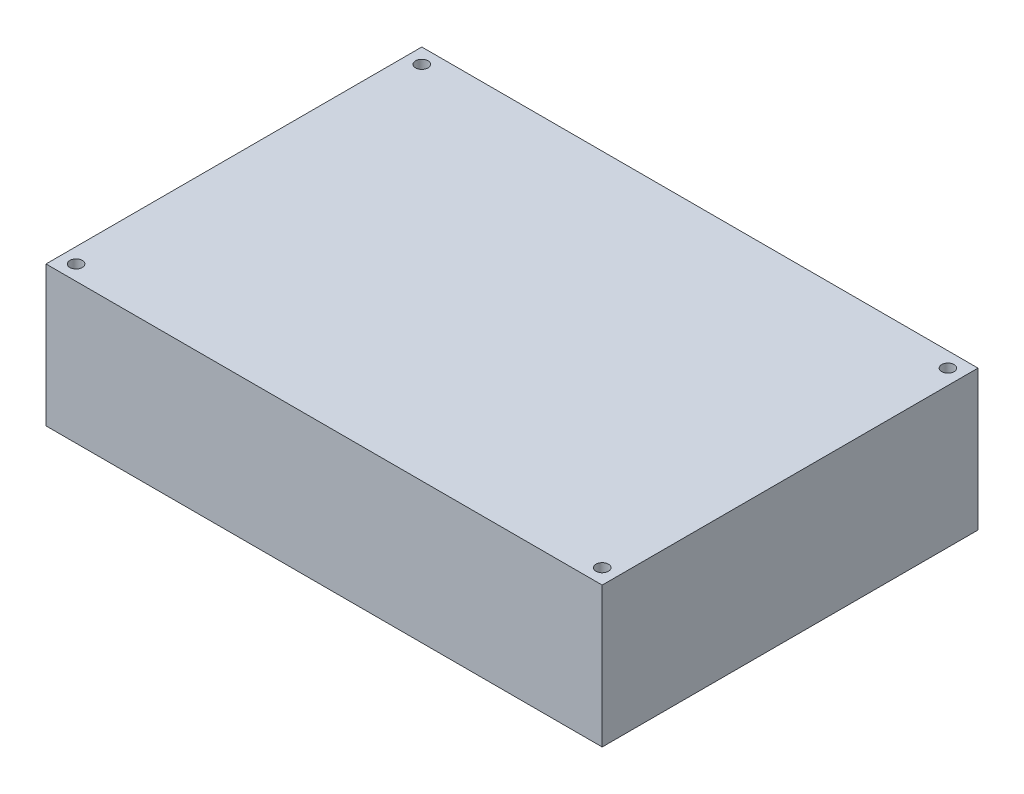
from build123d import *

# Parameters (mm, degrees)
SKETCH_1_W      = 93.98
SKETCH_1_H      = 63.5
SKETCH_1_R      = 1.05
EXTRUDE_1_DEPTH = 1.7
EXTRUDE_START   = 1.7
SKETCH_1_4_W    = 93.98
SKETCH_1_4_H    = 63.5
SKETCH_1_4_R    = 1.05
EXTRUDE_2_DEPTH = 22


with BuildPart() as part:
    # 草图1 → 凸台-拉伸1 (new body)
    with BuildSketch(Plane(origin=(0, 0, 0), x_dir=(1, 0, 0), z_dir=(0, 1, 0))):
        Rectangle(SKETCH_1_W, SKETCH_1_H)
        with Locations(Location((-44.45, 29.21, 0), (0, 0, 270))):
            Circle(SKETCH_1_R, mode=Mode.SUBTRACT)
        with Locations(Location((-44.45, -29.21, 0), (0, 0, 270))):
            Circle(SKETCH_1_R, mode=Mode.SUBTRACT)
        with Locations(Location((44.45, 29.21, 0), (0, 0, 270))):
            Circle(SKETCH_1_R, mode=Mode.SUBTRACT)
        with Locations(Location((44.45, -29.21, 0), (0, 0, 270))):
            Circle(SKETCH_1_R, mode=Mode.SUBTRACT)
    extrude(amount=EXTRUDE_1_DEPTH)

    # 草图1<4> → 凸台-拉伸2 (add)
    with BuildSketch(Plane(origin=(0, 0, 0), x_dir=(1, 0, 0), z_dir=(0, 1, 0)).offset(EXTRUDE_START)):
        Rectangle(SKETCH_1_4_W, SKETCH_1_4_H)
        with Locations(Location((-44.45, 29.21, 0), (0, 0, 90))):
            Circle(SKETCH_1_4_R, mode=Mode.SUBTRACT)
        with Locations(Location((-44.45, -29.21, 0), (0, 0, 90))):
            Circle(SKETCH_1_4_R, mode=Mode.SUBTRACT)
        with Locations(Location((44.45, 29.21, 0), (0, 0, 90))):
            Circle(SKETCH_1_4_R, mode=Mode.SUBTRACT)
        with Locations(Location((44.45, -29.21, 0), (0, 0, 90))):
            Circle(SKETCH_1_4_R, mode=Mode.SUBTRACT)
    extrude(amount=EXTRUDE_2_DEPTH)


solid = part.part
